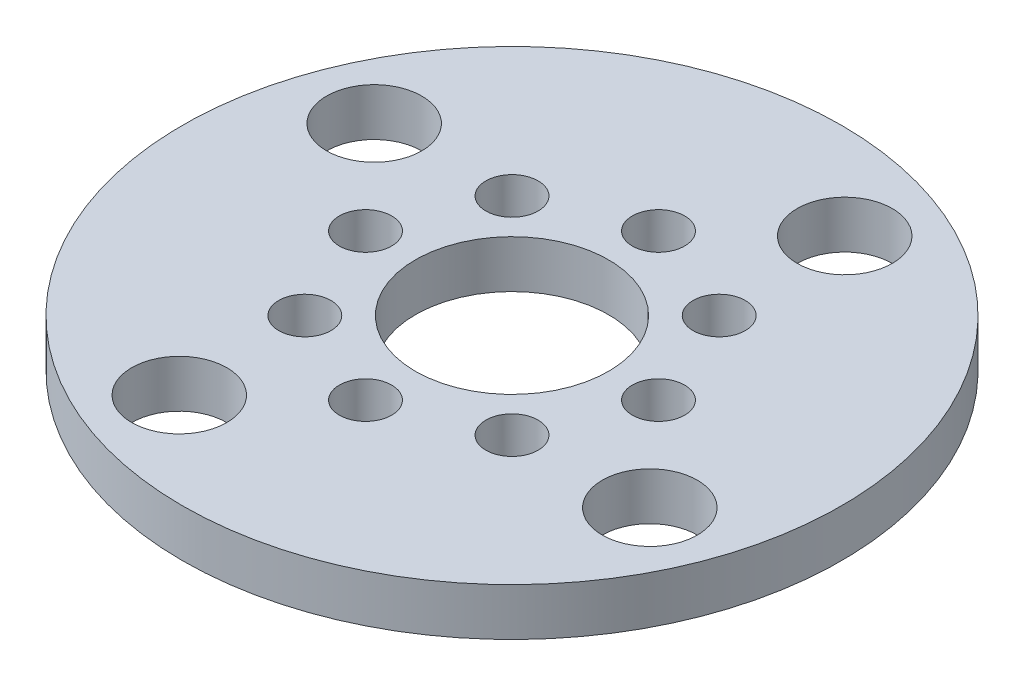
from build123d import *

# Parameters (mm, degrees)
SKETCH1_R           = 22
BOSS_EXTRUDE1_DEPTH = 3.175
SKETCH4_R           = 1.745
CUT_EXTRUDE2_DEPTH  = 32.274280567
SKETCH2_R           = 6.45
CUT_EXTRUDE4_DEPTH  = 32.274280567
CIRPATTERN1_COUNT   = 8
SKETCH5_R           = 3.175
CUT_EXTRUDE5_DEPTH  = 32.274280567
CIRPATTERN2_COUNT   = 4


with BuildPart() as part:
    # Sketch1 → Boss-Extrude1 (new body)
    with BuildSketch(Plane(origin=(0, 0, 0), x_dir=(1, 0, 0), z_dir=(0, 1, 0))):
        with Locations(Location((0, 0, 0), (0, 0, 270))):
            Circle(SKETCH1_R)
    extrude(amount=-BOSS_EXTRUDE1_DEPTH)

    # Sketch4 → Cut-Extrude2 (cut, symmetric)
    with BuildSketch(Plane(origin=(0, 0, 0), x_dir=(1, 0, 0), z_dir=(0, 1, 0))):
        with Locations(Location((0, -9.779, 0), (0, 0, 270))):
            Circle(SKETCH4_R)
    cut_extrude2 = extrude(amount=CUT_EXTRUDE2_DEPTH, both=True, mode=Mode.SUBTRACT)

    # Sketch2 → Cut-Extrude4 (cut, through all)
    with BuildSketch(Plane(origin=(0, 0, 0), x_dir=(1, 0, 0), z_dir=(0, 1, 0))):
        with Locations(Location((0, 0, 0), (0, 0, 270))):
            Circle(SKETCH2_R)
    extrude(amount=-CUT_EXTRUDE4_DEPTH, mode=Mode.SUBTRACT)

    # CirPattern1: Cut-Extrude2 ×8 about axis
    cirpattern1_axis = Axis((0, 0, 0), (0, 1, 0))
    for i in range(1, CIRPATTERN1_COUNT):
        add(cut_extrude2.rotate(cirpattern1_axis, i * 360 / CIRPATTERN1_COUNT), mode=Mode.SUBTRACT)

    # Sketch5 → Cut-Extrude5 (cut, through all)
    with BuildSketch(Plane(origin=(0, 0, 0), x_dir=(1, 0, 0), z_dir=(0, 1, 0))):
        with Locations(Location((6.50561835, 15.705952053, 0), (0, 0, 270))):
            Circle(SKETCH5_R)
    cut_extrude5 = extrude(amount=-CUT_EXTRUDE5_DEPTH, mode=Mode.SUBTRACT)

    # CirPattern2: Cut-Extrude5 ×4 about axis
    cirpattern2_axis = Axis((0, 0, 0), (0, 1, 0))
    for i in range(1, CIRPATTERN2_COUNT):
        add(cut_extrude5.rotate(cirpattern2_axis, i * 360 / CIRPATTERN2_COUNT), mode=Mode.SUBTRACT)


solid = part.part
